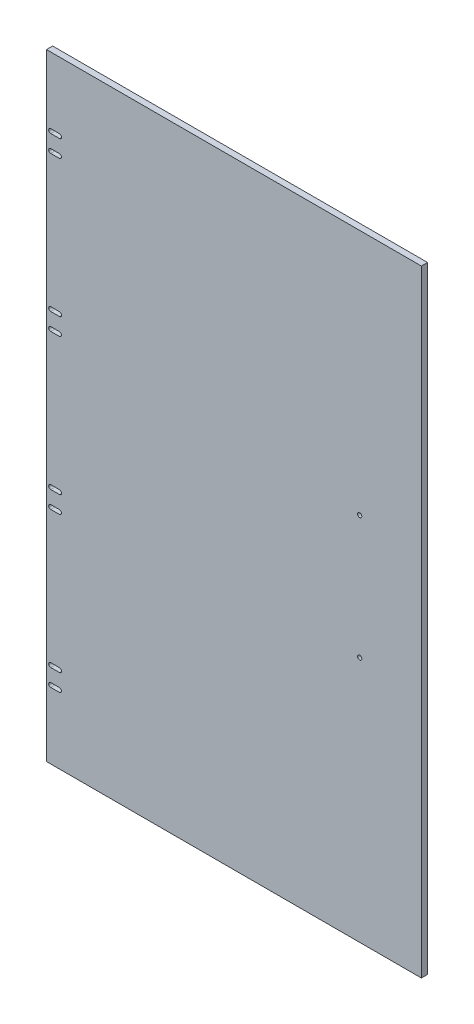
from build123d import *

# Parameters (mm, degrees)
ESQUISSE1_W             = 304
ESQUISSE1_H             = 500
BOSS_EXTRU_1_DEPTH      = 5
D_GAGEMENT_M34_D        = 3.4
ENL_V_MAT_EXTRU_3_REACH = 294.624


with BuildPart() as part:
    # Esquisse1 → Boss.-Extru.1 (new body)
    with BuildSketch(Plane.XY):
        Rectangle(ESQUISSE1_W, ESQUISSE1_H)
    extrude(amount=BOSS_EXTRU_1_DEPTH)

    # Dégagement M34 (through all)
    with Locations(Plane.XY.offset(5)):
        with Locations((102, -50), (102, 50)):
            Hole(D_GAGEMENT_M34_D / 2)

    # Esquisse15 → Enlèv. mat.-Extru.3 (cut, up to next)
    with BuildSketch(Plane.XY.offset(5), mode=Mode.PRIVATE) as enl_v_mat_extru_3_sk1:
        with BuildLine():
            Line((-148.5, -192.8), (-141.5, -192.8))
            ThreePointArc((-141.5, -192.8), (-139.8, -194.5), (-141.5, -196.2))
            Line((-141.5, -196.2), (-148.5, -196.2))
            ThreePointArc((-148.5, -196.2), (-150.2, -194.5), (-148.5, -192.8))
        make_face()
    enl_v_mat_extru_3_tool1 = extrude(enl_v_mat_extru_3_sk1.sketch, amount=-ENL_V_MAT_EXTRU_3_REACH, mode=Mode.PRIVATE) & part.part
    # Esquisse15 → Enlèv. mat.-Extru.3 (cut, up to next)
    with BuildSketch(Plane.XY.offset(5), mode=Mode.PRIVATE) as enl_v_mat_extru_3_sk2:
        with BuildLine():
            Line((-141.5, -182.2), (-148.5, -182.2))
            ThreePointArc((-148.5, -182.2), (-150.2, -180.5), (-148.5, -178.8))
            Line((-148.5, -178.8), (-141.5, -178.8))
            ThreePointArc((-141.5, -178.8), (-139.8, -180.5), (-141.5, -182.2))
        make_face()
    enl_v_mat_extru_3_tool2 = extrude(enl_v_mat_extru_3_sk2.sketch, amount=-ENL_V_MAT_EXTRU_3_REACH, mode=Mode.PRIVATE) & part.part
    # Esquisse15 → Enlèv. mat.-Extru.3 (cut, up to next)
    with BuildSketch(Plane.XY.offset(5), mode=Mode.PRIVATE) as enl_v_mat_extru_3_sk3:
        with BuildLine():
            Line((-148.5, -67.8), (-141.5, -67.8))
            ThreePointArc((-141.5, -67.8), (-139.8, -69.5), (-141.5, -71.2))
            Line((-141.5, -71.2), (-148.5, -71.2))
            ThreePointArc((-148.5, -71.2), (-150.2, -69.5), (-148.5, -67.8))
        make_face()
    enl_v_mat_extru_3_tool3 = extrude(enl_v_mat_extru_3_sk3.sketch, amount=-ENL_V_MAT_EXTRU_3_REACH, mode=Mode.PRIVATE) & part.part
    # Esquisse15 → Enlèv. mat.-Extru.3 (cut, up to next)
    with BuildSketch(Plane.XY.offset(5), mode=Mode.PRIVATE) as enl_v_mat_extru_3_sk4:
        with BuildLine():
            Line((-141.5, -57.2), (-148.5, -57.2))
            ThreePointArc((-148.5, -57.2), (-150.2, -55.5), (-148.5, -53.8))
            Line((-148.5, -53.8), (-141.5, -53.8))
            ThreePointArc((-141.5, -53.8), (-139.8, -55.5), (-141.5, -57.2))
        make_face()
    enl_v_mat_extru_3_tool4 = extrude(enl_v_mat_extru_3_sk4.sketch, amount=-ENL_V_MAT_EXTRU_3_REACH, mode=Mode.PRIVATE) & part.part
    # Esquisse15 → Enlèv. mat.-Extru.3 (cut, up to next)
    with BuildSketch(Plane.XY.offset(5), mode=Mode.PRIVATE) as enl_v_mat_extru_3_sk5:
        with BuildLine():
            Line((-148.5, 57.2), (-141.5, 57.2))
            ThreePointArc((-141.5, 57.2), (-139.8, 55.5), (-141.5, 53.8))
            Line((-141.5, 53.8), (-148.5, 53.8))
            ThreePointArc((-148.5, 53.8), (-150.2, 55.5), (-148.5, 57.2))
        make_face()
    enl_v_mat_extru_3_tool5 = extrude(enl_v_mat_extru_3_sk5.sketch, amount=-ENL_V_MAT_EXTRU_3_REACH, mode=Mode.PRIVATE) & part.part
    # Esquisse15 → Enlèv. mat.-Extru.3 (cut, up to next)
    with BuildSketch(Plane.XY.offset(5), mode=Mode.PRIVATE) as enl_v_mat_extru_3_sk6:
        with BuildLine():
            Line((-141.5, 67.8), (-148.5, 67.8))
            ThreePointArc((-148.5, 67.8), (-150.2, 69.5), (-148.5, 71.2))
            Line((-148.5, 71.2), (-141.5, 71.2))
            ThreePointArc((-141.5, 71.2), (-139.8, 69.5), (-141.5, 67.8))
        make_face()
    enl_v_mat_extru_3_tool6 = extrude(enl_v_mat_extru_3_sk6.sketch, amount=-ENL_V_MAT_EXTRU_3_REACH, mode=Mode.PRIVATE) & part.part
    # Esquisse15 → Enlèv. mat.-Extru.3 (cut, up to next)
    with BuildSketch(Plane.XY.offset(5), mode=Mode.PRIVATE) as enl_v_mat_extru_3_sk7:
        with BuildLine():
            Line((-148.5, 182.2), (-141.5, 182.2))
            ThreePointArc((-141.5, 182.2), (-139.8, 180.5), (-141.5, 178.8))
            Line((-141.5, 178.8), (-148.5, 178.8))
            ThreePointArc((-148.5, 178.8), (-150.2, 180.5), (-148.5, 182.2))
        make_face()
    enl_v_mat_extru_3_tool7 = extrude(enl_v_mat_extru_3_sk7.sketch, amount=-ENL_V_MAT_EXTRU_3_REACH, mode=Mode.PRIVATE) & part.part
    # Esquisse15 → Enlèv. mat.-Extru.3 (cut, up to next)
    with BuildSketch(Plane.XY.offset(5), mode=Mode.PRIVATE) as enl_v_mat_extru_3_sk8:
        with BuildLine():
            Line((-141.5, 192.8), (-148.5, 192.8))
            ThreePointArc((-148.5, 192.8), (-150.2, 194.5), (-148.5, 196.2))
            Line((-148.5, 196.2), (-141.5, 196.2))
            ThreePointArc((-141.5, 196.2), (-139.8, 194.5), (-141.5, 192.8))
        make_face()
    enl_v_mat_extru_3_tool8 = extrude(enl_v_mat_extru_3_sk8.sketch, amount=-ENL_V_MAT_EXTRU_3_REACH, mode=Mode.PRIVATE) & part.part
    add(enl_v_mat_extru_3_tool1.solids().sort_by_distance((-145, -194.5, 5))[0], mode=Mode.SUBTRACT)
    add(enl_v_mat_extru_3_tool2.solids().sort_by_distance((-145, -180.5, 5))[0], mode=Mode.SUBTRACT)
    add(enl_v_mat_extru_3_tool3.solids().sort_by_distance((-145, -69.5, 5))[0], mode=Mode.SUBTRACT)
    add(enl_v_mat_extru_3_tool4.solids().sort_by_distance((-145, -55.5, 5))[0], mode=Mode.SUBTRACT)
    add(enl_v_mat_extru_3_tool5.solids().sort_by_distance((-145, 55.5, 5))[0], mode=Mode.SUBTRACT)
    add(enl_v_mat_extru_3_tool6.solids().sort_by_distance((-145, 69.5, 5))[0], mode=Mode.SUBTRACT)
    add(enl_v_mat_extru_3_tool7.solids().sort_by_distance((-145, 180.5, 5))[0], mode=Mode.SUBTRACT)
    add(enl_v_mat_extru_3_tool8.solids().sort_by_distance((-145, 194.5, 5))[0], mode=Mode.SUBTRACT)


solid = part.part
